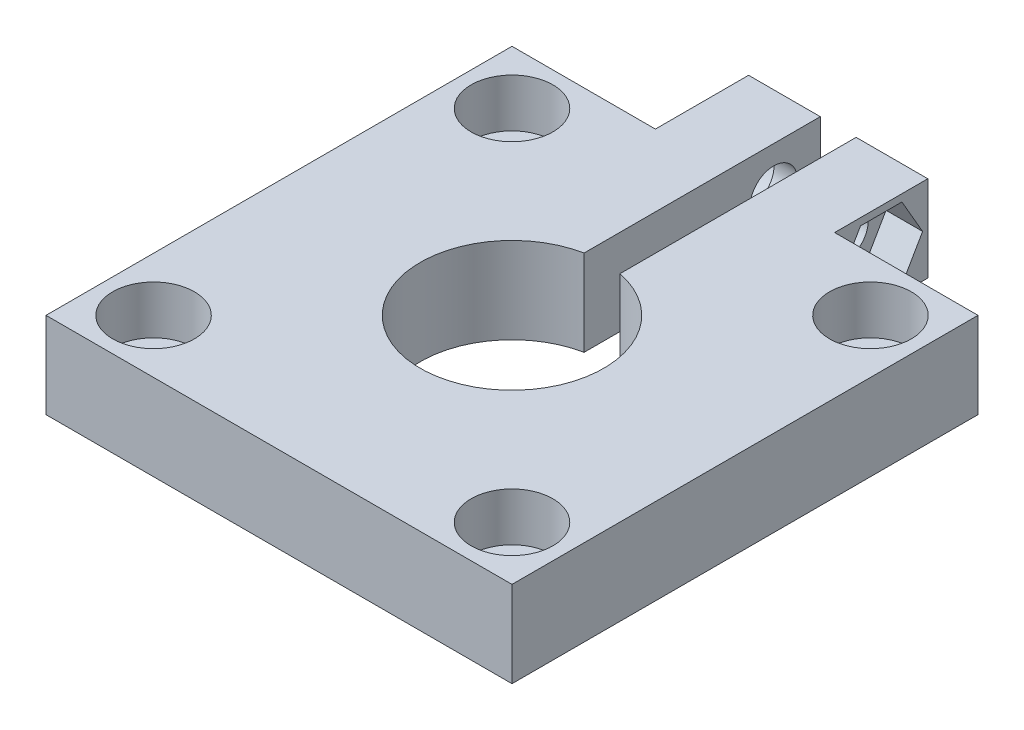
from build123d import *

# Parameters (mm, degrees)
SKETCH1_W                                           = 65
SKETCH1_H                                           = 65
BOSS_EXTRUDE1_DEPTH                                 = 12
SKETCH3_R                                           = 12.8
CUT_EXTRUDE1_DEPTH                                  = 12
SKETCH4_W                                           = 5
SKETCH4_H                                           = 40
CUT_EXTRUDE2_DEPTH                                  = 12
SKETCH5_W                                           = 10
SKETCH5_H                                           = 13
BOSS_EXTRUDE4_DEPTH                                 = 12
LPATTERN1_COUNT                                     = 2
LPATTERN1_PITCH                                     = 15
CBORE_FOR_M6_HEX_SOCKET_HEAD_CAP_SCREW1_D           = 6.6
CBORE_FOR_M6_HEX_SOCKET_HEAD_CAP_SCREW1_CBORE_D     = 10.5
CBORE_FOR_M6_HEX_SOCKET_HEAD_CAP_SCREW1_CBORE_DEPTH = 6.75
CUT_EXTRUDE3_DEPTH                                  = 5.1
CBORE_FOR_M6_HEX_SOCKET_HEAD_CAP_SCREW2_D           = 7.5
CBORE_FOR_M6_HEX_SOCKET_HEAD_CAP_SCREW2_CBORE_D     = 11.4
CBORE_FOR_M6_HEX_SOCKET_HEAD_CAP_SCREW2_CBORE_DEPTH = 6.75
CBORE_FOR_M6_HEX_SOCKET_HEAD_CAP_SCREW3_D           = 7.5
CBORE_FOR_M6_HEX_SOCKET_HEAD_CAP_SCREW3_CBORE_D     = 11.4
CBORE_FOR_M6_HEX_SOCKET_HEAD_CAP_SCREW3_CBORE_DEPTH = 6.75
CBORE_FOR_M6_HEX_SOCKET_HEAD_CAP_SCREW4_D           = 7.5
CBORE_FOR_M6_HEX_SOCKET_HEAD_CAP_SCREW4_CBORE_D     = 11.4
CBORE_FOR_M6_HEX_SOCKET_HEAD_CAP_SCREW4_CBORE_DEPTH = 6.75
CBORE_FOR_M6_HEX_SOCKET_HEAD_CAP_SCREW5_D           = 7.5
CBORE_FOR_M6_HEX_SOCKET_HEAD_CAP_SCREW5_CBORE_D     = 11.4
CBORE_FOR_M6_HEX_SOCKET_HEAD_CAP_SCREW5_CBORE_DEPTH = 6.75


with BuildPart() as part:
    # Sketch1 → Boss-Extrude1 (new body)
    with BuildSketch(Plane(origin=(0, 0, 0), x_dir=(1, 0, 0), z_dir=(0, 1, 0))):
        Rectangle(SKETCH1_W, SKETCH1_H)
    extrude(amount=BOSS_EXTRUDE1_DEPTH)

    # Sketch3 → Cut-Extrude1 (cut)
    with BuildSketch(Plane(origin=(0, 12, 0), x_dir=(-1, 0, 0), z_dir=(0, 1, 0))):
        with Locations(Location((0, 0, 0), (0, 0, 90))):
            Circle(SKETCH3_R)
    extrude(amount=-CUT_EXTRUDE1_DEPTH, mode=Mode.SUBTRACT)

    # Sketch4 → Cut-Extrude2 (cut)
    with BuildSketch(Plane(origin=(0, 12, 0), x_dir=(-1, 0, 0), z_dir=(0, 1, 0))):
        with Locations((0, -32.5)):
            Rectangle(SKETCH4_W, SKETCH4_H)
    extrude(amount=-CUT_EXTRUDE2_DEPTH, mode=Mode.SUBTRACT)

    # Sketch5 → Boss-Extrude4 (add)
    with BuildSketch(Plane(origin=(0, 12, 0), x_dir=(-1, 0, 0), z_dir=(0, 1, 0))):
        with Locations((7.5, -39)):
            Rectangle(SKETCH5_W, SKETCH5_H)
    boss_extrude4 = extrude(amount=-BOSS_EXTRUDE4_DEPTH)

    # LPattern1: Boss-Extrude4 ×2
    with Locations(*[(i * LPATTERN1_PITCH, 0, 0) for i in range(1, LPATTERN1_COUNT)]):
        add(boss_extrude4)

    # CBORE for M6 Hex Socket Head Cap Screw1 (through all)
    with Locations(Plane.ZY.offset(12.5)):
        with Locations((-39, 6)):
            CounterBoreHole(CBORE_FOR_M6_HEX_SOCKET_HEAD_CAP_SCREW1_D / 2, CBORE_FOR_M6_HEX_SOCKET_HEAD_CAP_SCREW1_CBORE_D / 2, CBORE_FOR_M6_HEX_SOCKET_HEAD_CAP_SCREW1_CBORE_DEPTH)

    # Sketch9 → Cut-Extrude3 (cut)
    with BuildSketch(Plane(origin=(12.5, 0, 0), x_dir=(0, 0, -1), z_dir=(1, 0, 0))):
        Polygon((44.773502692, 6), (41.886751346, 11), (36.113248654, 11), (33.226497308, 6), (36.113248654, 1), (41.886751346, 1), align=None)
    extrude(amount=-CUT_EXTRUDE3_DEPTH, mode=Mode.SUBTRACT)

    # CBORE for M6 Hex Socket Head Cap Screw2 (through all)
    with Locations(Plane(origin=(0, 12, 0), x_dir=(-1, 0, 0), z_dir=(0, 1, 0))):
        with Locations((25, -25)):
            CounterBoreHole(CBORE_FOR_M6_HEX_SOCKET_HEAD_CAP_SCREW2_D / 2, CBORE_FOR_M6_HEX_SOCKET_HEAD_CAP_SCREW2_CBORE_D / 2, CBORE_FOR_M6_HEX_SOCKET_HEAD_CAP_SCREW2_CBORE_DEPTH)

    # CBORE for M6 Hex Socket Head Cap Screw3 (through all)
    with Locations(Plane(origin=(0, 12, 0), x_dir=(-1, 0, 0), z_dir=(0, 1, 0))):
        with Locations((-25, -25)):
            CounterBoreHole(CBORE_FOR_M6_HEX_SOCKET_HEAD_CAP_SCREW3_D / 2, CBORE_FOR_M6_HEX_SOCKET_HEAD_CAP_SCREW3_CBORE_D / 2, CBORE_FOR_M6_HEX_SOCKET_HEAD_CAP_SCREW3_CBORE_DEPTH)

    # CBORE for M6 Hex Socket Head Cap Screw4 (through all)
    with Locations(Plane(origin=(0, 12, 0), x_dir=(-1, 0, 0), z_dir=(0, 1, 0))):
        with Locations((-25, 25)):
            CounterBoreHole(CBORE_FOR_M6_HEX_SOCKET_HEAD_CAP_SCREW4_D / 2, CBORE_FOR_M6_HEX_SOCKET_HEAD_CAP_SCREW4_CBORE_D / 2, CBORE_FOR_M6_HEX_SOCKET_HEAD_CAP_SCREW4_CBORE_DEPTH)

    # CBORE for M6 Hex Socket Head Cap Screw5 (through all)
    with Locations(Plane(origin=(0, 12, 0), x_dir=(-1, 0, 0), z_dir=(0, 1, 0))):
        with Locations((25, 25)):
            CounterBoreHole(CBORE_FOR_M6_HEX_SOCKET_HEAD_CAP_SCREW5_D / 2, CBORE_FOR_M6_HEX_SOCKET_HEAD_CAP_SCREW5_CBORE_D / 2, CBORE_FOR_M6_HEX_SOCKET_HEAD_CAP_SCREW5_CBORE_DEPTH)


solid = part.part
